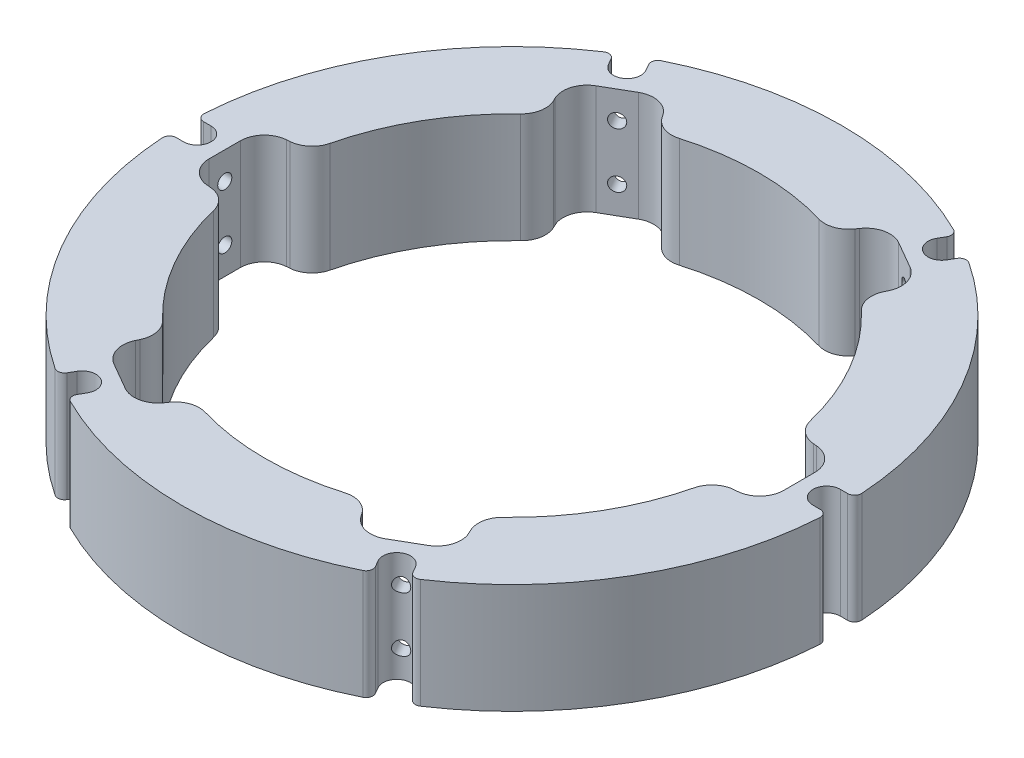
from build123d import *

# Parameters (mm, degrees)
SKETCH1_R                        = 76.2
SKETCH1_R_2                      = 57.15
BOSS_EXTRUDE1_DEPTH              = 12.7
CUT_EXTRUDE1_START               = -12.7
CUT_EXTRUDE1_DEPTH               = 12.7
CUT_EXTRUDE2_DEPTH               = 109.508847566
F_30_0_1285_DIAMETER_HOLE1_D     = 3.2639
F_30_0_1285_DIAMETER_HOLE1_DEPTH = 9.712825433
FILLET1_R                        = 1.5875
FILLET2_R                        = 5.55625
CIRPATTERN1_COUNT                = 6
FILLET1_OF_CIRPATTERN1_R         = 1.5875
FILLET2_OF_CIRPATTERN1_R         = 5.55625


with BuildPart() as part:
    # Sketch1 → Boss-Extrude1 (new body)
    with BuildSketch(Plane(origin=(0, 0, 0), x_dir=(1, 0, 0), z_dir=(0, 1, 0))):
        with Locations(Location((0, 0, 0), (0, 0, 270))):
            Circle(SKETCH1_R)
        with Locations(Location((0, 0, 0), (0, 0, 270))):
            Circle(SKETCH1_R_2, mode=Mode.SUBTRACT)
    extrude(amount=-BOSS_EXTRUDE1_DEPTH)

    # Sketch3 → Cut-Extrude1 (cut)
    with BuildSketch(Plane(origin=(0, -12.7, 0), x_dir=(-1, 0, 0), z_dir=(0, -1, 0)).offset(CUT_EXTRUDE1_START)):
        with BuildLine():
            Line((-76.133825433, 3.175), (-72.771, 3.175))
            ThreePointArc((-72.771, 3.175), (-69.596, 0), (-72.771, -3.175))
            Line((-72.771, -3.175), (-76.133825433, -3.175))
            ThreePointArc((-76.133825433, -3.175), (-76.2, 0), (-76.133825433, 3.175))
        make_face()
    cut_extrude1 = extrude(amount=CUT_EXTRUDE1_DEPTH, mode=Mode.SUBTRACT)

    # Sketch4 → Cut-Extrude2 (cut, through all)
    with BuildSketch(Plane(origin=(0, -12.7, 0), x_dir=(-1, 0, 0), z_dir=(0, -1, 0))):
        Polygon((-66.421, 8.73125), (-66.421, -8.73125), (-56.350659934, -9.525), (-56.350659934, 9.525), align=None)
    cut_extrude2 = extrude(amount=-CUT_EXTRUDE2_DEPTH, mode=Mode.SUBTRACT)

    # #30 (0.1285) Diameter Hole1
    with Locations(Plane.ZY.offset(-66.421)):
        with Locations((0, -6.35)):
            f_30_0_1285_diameter_hole1 = Hole(F_30_0_1285_DIAMETER_HOLE1_D / 2, depth=F_30_0_1285_DIAMETER_HOLE1_DEPTH)

    # Fillet1
    fillet1_edges = [part.edges().sort_by_distance(p)[0] for p in [
        (76.133825433, -6.35, 3.175),
        (76.133825433, -6.35, -3.175),
    ]]
    fillet(fillet1_edges, radius=FILLET1_R)

    # Fillet2
    fillet2_edges = [part.edges().sort_by_distance(p)[0] for p in [
        (66.421, -6.35, -8.73125),
        (56.350659934, -6.35, -9.525),
        (56.350659934, -6.35, 9.525),
        (66.421, -6.35, 8.73125),
    ]]
    fillet(fillet2_edges, radius=FILLET2_R)

    # CirPattern1: Cut-Extrude1, Cut-Extrude2, #30 (0.1285) Diameter Hole1 ×6 about axis
    cirpattern1_axis = Axis((0, 0, 0), (0, 1, 0))
    add([cut_extrude1.rotate(cirpattern1_axis, i * 360 / CIRPATTERN1_COUNT) for i in range(1, CIRPATTERN1_COUNT)], mode=Mode.SUBTRACT)
    add([cut_extrude2.rotate(cirpattern1_axis, i * 360 / CIRPATTERN1_COUNT) for i in range(1, CIRPATTERN1_COUNT)], mode=Mode.SUBTRACT)
    add([f_30_0_1285_diameter_hole1.rotate(cirpattern1_axis, i * 360 / CIRPATTERN1_COUNT) for i in range(1, CIRPATTERN1_COUNT)], mode=Mode.SUBTRACT)

    # Fillet1 of CirPattern1
    fillet1_of_cirpattern1_edges = [part.edges().sort_by_distance(p)[0] for p in [
        (40.816543373, -6.35, -64.346326912),
        (35.317282059, -6.35, -67.521326912),
        (-35.317282059, -6.35, -67.521326912),
        (-40.816543373, -6.35, -64.346326912),
        (-76.133825433, -6.35, -3.175),
        (-76.133825433, -6.35, 3.175),
        (-40.816543373, -6.35, 64.346326912),
        (-35.317282059, -6.35, 67.521326912),
        (35.317282059, -6.35, 67.521326912),
        (40.816543373, -6.35, 64.346326912),
    ]]
    fillet(fillet1_of_cirpattern1_edges, radius=FILLET1_OF_CIRPATTERN1_R)

    # Fillet2 of CirPattern1
    fillet2_of_cirpattern1_edges = [part.edges().sort_by_distance(p)[0] for p in [
        (25.649015693, -6.35, -61.887898345),
        (19.926437996, -6.35, -53.563603023),
        (36.424221938, -6.35, -44.038603023),
        (40.771984307, -6.35, -53.156648345),
        (-40.771984307, -6.35, -53.156648345),
        (-36.424221938, -6.35, -44.038603023),
        (-19.926437996, -6.35, -53.563603023),
        (-25.649015693, -6.35, -61.887898345),
        (-66.421, -6.35, 8.73125),
        (-56.350659934, -6.35, 9.525),
        (-56.350659934, -6.35, -9.525),
        (-66.421, -6.35, -8.73125),
        (-25.649015693, -6.35, 61.887898345),
        (-19.926437996, -6.35, 53.563603023),
        (-36.424221938, -6.35, 44.038603023),
        (-40.771984307, -6.35, 53.156648345),
        (40.771984307, -6.35, 53.156648345),
        (36.424221938, -6.35, 44.038603023),
        (19.926437996, -6.35, 53.563603023),
        (25.649015693, -6.35, 61.887898345),
    ]]
    fillet(fillet2_of_cirpattern1_edges, radius=FILLET2_OF_CIRPATTERN1_R)

    # Mirror3: part across plane


with BuildPart() as part_1:
    add(part.part)
    add(part.part.mirror(Plane.ZX))


solid = part_1.part
